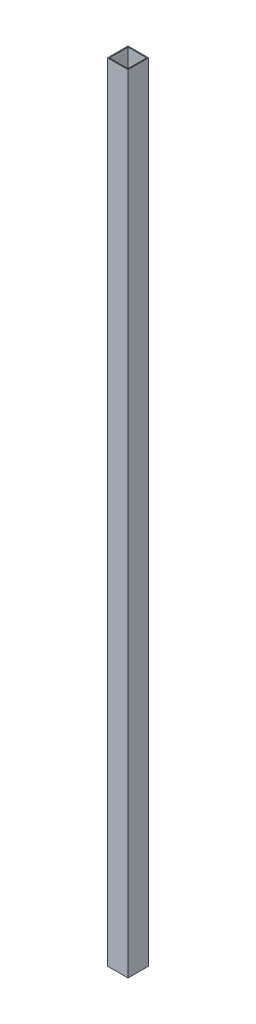
from build123d import *

# Parameters (mm, degrees)
SKETCH1_W           = 50
SKETCH1_H           = 50
SKETCH1_W_2         = 45.6
SKETCH1_H_2         = 45.6
BOSS_EXTRUDE1_DEPTH = 1923


with BuildPart() as part:
    # Sketch1 → Boss-Extrude1 (new body)
    with BuildSketch(Plane(origin=(0, 0, 0), x_dir=(1, 0, 0), z_dir=(0, 1, 0))):
        with Locations((25, 25)):
            Rectangle(SKETCH1_W, SKETCH1_H)
        with Locations((25, 25)):
            Rectangle(SKETCH1_W_2, SKETCH1_H_2, mode=Mode.SUBTRACT)
    extrude(amount=BOSS_EXTRUDE1_DEPTH)


solid = part.part
